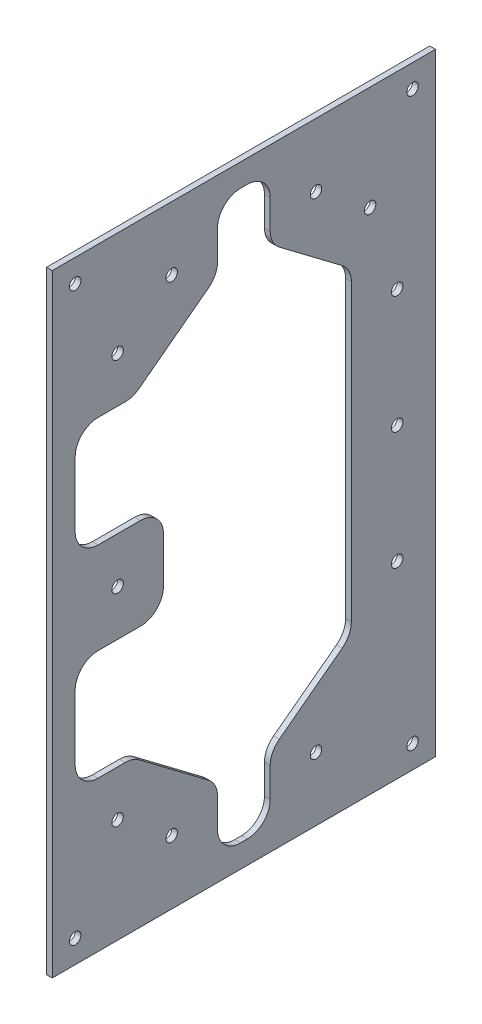
from build123d import *

# Parameters (mm, degrees)
SKETCH1_W           = 212.5
SKETCH1_H           = 339.725
SKETCH1_R           = 3.175
BOSS_EXTRUDE1_DEPTH = 3.175
CUT_EXTRUDE1_DEPTH  = 401.72360331


with BuildPart() as part:
    # Sketch1 → Boss-Extrude1 (new body)
    with BuildSketch(Plane(origin=(0, 0, 0), x_dir=(0, 0, -1), z_dir=(1, 0, 0))):
        with Locations((106.25, -169.8625)):
            Rectangle(SKETCH1_W, SKETCH1_H)
        with Locations((12.7, -12.7)):
            Circle(SKETCH1_R, mode=Mode.SUBTRACT)
        with Locations((199.8, -12.7)):
            Circle(SKETCH1_R, mode=Mode.SUBTRACT)
        with Locations((66.25, -35.2425)):
            Circle(SKETCH1_R, mode=Mode.SUBTRACT)
        with Locations((146.25, -35.2425)):
            Circle(SKETCH1_R, mode=Mode.SUBTRACT)
        with Locations((176.25, -57.8625)):
            Circle(SKETCH1_R, mode=Mode.SUBTRACT)
        with Locations((36.25, -57.8625)):
            Circle(SKETCH1_R, mode=Mode.SUBTRACT)
        with Locations((191.25, -104.5325)):
            Circle(SKETCH1_R, mode=Mode.SUBTRACT)
        with Locations((36.25, -169.8625)):
            Circle(SKETCH1_R, mode=Mode.SUBTRACT)
        with Locations((191.25, -169.8625)):
            Circle(SKETCH1_R, mode=Mode.SUBTRACT)
        with Locations((36.25, -281.8625)):
            Circle(SKETCH1_R, mode=Mode.SUBTRACT)
        with Locations((66.25, -304.4825)):
            Circle(SKETCH1_R, mode=Mode.SUBTRACT)
        with Locations((12.7, -327.025)):
            Circle(SKETCH1_R, mode=Mode.SUBTRACT)
        with Locations((199.8, -327.025)):
            Circle(SKETCH1_R, mode=Mode.SUBTRACT)
        with Locations((146.25, -304.4825)):
            Circle(SKETCH1_R, mode=Mode.SUBTRACT)
        with Locations(Location((191.25, -235.1925, 0), (0, 0, 180))):
            Circle(SKETCH1_R, mode=Mode.SUBTRACT)
    extrude(amount=BOSS_EXTRUDE1_DEPTH)

    # Sketch2 → Cut-Extrude1 (cut, through all)
    with BuildSketch(Plane(origin=(3.175, 0, 0), x_dir=(0, 0, -1), z_dir=(1, 0, 0))):
        with BuildLine():
            Line((165.85, -88.161695758), (165.85, -251.563304242))
            ThreePointArc((165.85, -251.563304242), (164.516472011, -257.22840036), (160.795934799, -261.703801323))
            Line((160.795934799, -261.703801323), (125.904065201, -288.012271))
            ThreePointArc((125.904065201, -288.012271), (122.183527989, -292.487671963), (120.85, -298.152768081))
            Line((120.85, -298.152768081), (120.85, -314.325))
            ThreePointArc((120.85, -314.325), (117.130256121, -323.305256121), (108.15, -327.025))
            Line((108.15, -327.025), (104.35, -327.025))
            ThreePointArc((104.35, -327.025), (95.369743879, -323.305256121), (91.65, -314.325))
            Line((91.65, -314.325), (91.65, -298.152768081))
            ThreePointArc((91.65, -298.152768081), (90.316472011, -292.487671963), (86.595934799, -288.012271))
            Line((86.595934799, -288.012271), (48.147303392, -259.022002919))
            ThreePointArc((48.147303392, -259.022002919), (44.532850149, -257.119362682), (40.501368593, -256.4625))
            Line((40.501368593, -256.4625), (25.4, -256.4625))
            ThreePointArc((25.4, -256.4625), (16.419743879, -252.742756121), (12.7, -243.7625))
            Line((12.7, -243.7625), (12.7, -207.9625))
            ThreePointArc((12.7, -207.9625), (16.419743879, -198.982243879), (25.4, -195.2625))
            Line((25.4, -195.2625), (48.95, -195.2625))
            ThreePointArc((48.95, -195.2625), (57.930256121, -191.542756121), (61.65, -182.5625))
            Line((61.65, -182.5625), (61.65, -157.1625))
            ThreePointArc((61.65, -157.1625), (57.930256121, -148.182243879), (48.95, -144.4625))
            Line((48.95, -144.4625), (25.4, -144.4625))
            ThreePointArc((25.4, -144.4625), (16.419743879, -140.742756121), (12.7, -131.7625))
            Line((12.7, -131.7625), (12.7, -95.9625))
            ThreePointArc((12.7, -95.9625), (16.419743879, -86.982243879), (25.4, -83.2625))
            Line((25.4, -83.2625), (40.501368593, -83.2625))
            ThreePointArc((40.501368593, -83.2625), (44.532850149, -82.605637318), (48.147303392, -80.702997081))
            Line((48.147303392, -80.702997081), (86.595934799, -51.712729))
            ThreePointArc((86.595934799, -51.712729), (90.316472011, -47.237328037), (91.65, -41.572231919))
            Line((91.65, -41.572231919), (91.65, -25.4))
            ThreePointArc((91.65, -25.4), (95.369743879, -16.419743879), (104.35, -12.7))
            Line((104.35, -12.7), (108.15, -12.7))
            ThreePointArc((108.15, -12.7), (117.130256121, -16.419743879), (120.85, -25.4))
            Line((120.85, -25.4), (120.85, -41.572231919))
            ThreePointArc((120.85, -41.572231919), (122.183527989, -47.237328037), (125.904065201, -51.712729))
            Line((125.904065201, -51.712729), (160.795934799, -78.021198677))
            ThreePointArc((160.795934799, -78.021198677), (164.516472011, -82.49659964), (165.85, -88.161695758))
        make_face()
    extrude(amount=-CUT_EXTRUDE1_DEPTH, mode=Mode.SUBTRACT)


solid = part.part
